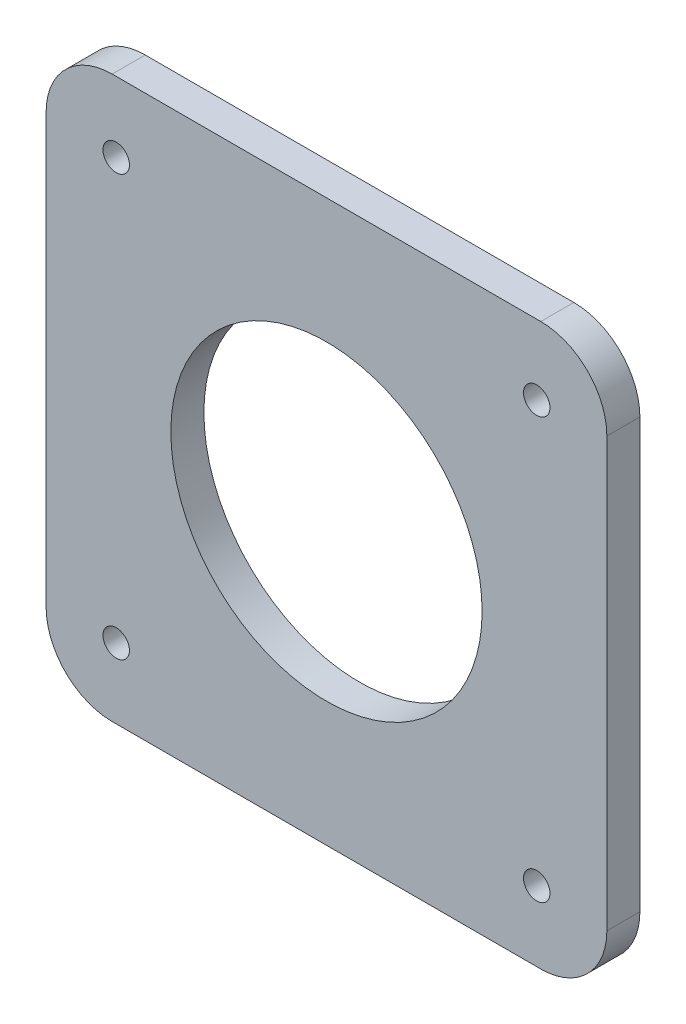
from build123d import *

# Parameters (mm, degrees)
SKETCH1_R           = 23.55
SKETCH1_R_2         = 2
BOSS_EXTRUDE1_DEPTH = 5


with BuildPart() as part:
    # Sketch1 → Boss-Extrude1 (new body)
    with BuildSketch(Plane.XY):
        with BuildLine():
            Line((-5.535475367, 65.430655792), (59.314524633, 65.430655792))
            ThreePointArc((59.314524633, 65.430655792), (66.385592445, 62.501723604), (69.314524633, 55.430655792))
            Line((69.314524633, 55.430655792), (69.314524633, -9.419344208))
            ThreePointArc((69.314524633, -9.419344208), (66.385592445, -16.49041202), (59.314524633, -19.419344208))
            Line((59.314524633, -19.419344208), (-5.535475367, -19.419344208))
            ThreePointArc((-5.535475367, -19.419344208), (-12.606543178, -16.49041202), (-15.535475367, -9.419344208))
            Line((-15.535475367, -9.419344208), (-15.535475367, 55.430655792))
            ThreePointArc((-15.535475367, 55.430655792), (-12.606543178, 62.501723604), (-5.535475367, 65.430655792))
        make_face()
        with Locations((26.889524633, 23.005655792)):
            Circle(SKETCH1_R, mode=Mode.SUBTRACT)
        with Locations((-4.925475367, 54.820655792)):
            Circle(SKETCH1_R_2, mode=Mode.SUBTRACT)
        with Locations((-4.925475367, -8.809344208)):
            Circle(SKETCH1_R_2, mode=Mode.SUBTRACT)
        with Locations((58.704524633, 54.820655792)):
            Circle(SKETCH1_R_2, mode=Mode.SUBTRACT)
        with Locations((58.704524633, -8.809344208)):
            Circle(SKETCH1_R_2, mode=Mode.SUBTRACT)
    extrude(amount=BOSS_EXTRUDE1_DEPTH)


solid = part.part
